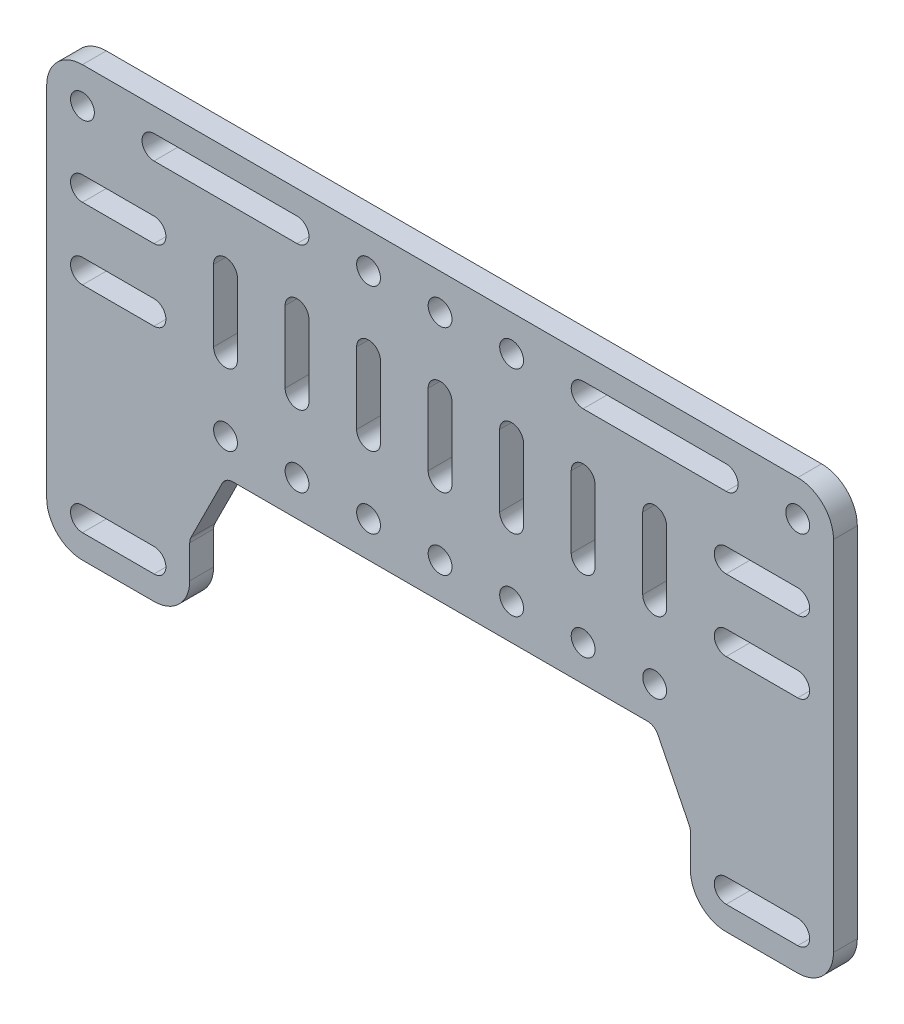
from build123d import *

# Parameters (mm, degrees)
MODEL_R                 = 1.5
SALIENTE_EXTRUIR1_DEPTH = 3


with BuildPart() as part:
    # Model → Saliente-Extruir1 (new body)
    with BuildSketch(Plane.XY):
        with BuildLine():
            Line((-1388.226934946, 304.407679238), (-1478.226934946, 304.407679238))
            ThreePointArc((-1478.226934946, 304.407679238), (-1481.408915461, 303.089659753), (-1482.726934946, 299.907679238))
            Line((-1482.726934946, 299.907679238), (-1482.726934946, 254.907679238))
            ThreePointArc((-1482.726934946, 254.907679238), (-1481.408915461, 251.725698722), (-1478.226934946, 250.407679238))
            Line((-1478.226934946, 250.407679238), (-1469.226934946, 250.407679238))
            ThreePointArc((-1469.226934946, 250.407679238), (-1466.04495443, 251.725698722), (-1464.726934946, 254.907679238))
            Line((-1464.726934946, 254.907679238), (-1464.726934946, 259.053577271))
            ThreePointArc((-1464.726934946, 259.053577271), (-1464.68680843, 259.398206652), (-1464.568575732, 259.724397665))
            Line((-1464.568575732, 259.724397665), (-1460.641524749, 267.578499631))
            ThreePointArc((-1460.641524749, 267.578499631), (-1460.088480631, 268.18365545), (-1459.299883963, 268.407679238))
            Line((-1459.299883963, 268.407679238), (-1407.153985929, 268.407679238))
            ThreePointArc((-1407.153985929, 268.407679238), (-1406.365389261, 268.18365545), (-1405.812345142, 267.578499631))
            Line((-1405.812345142, 267.578499631), (-1401.885294159, 259.724397665))
            ThreePointArc((-1401.885294159, 259.724397665), (-1401.767061462, 259.398206652), (-1401.726934946, 259.053577271))
            Line((-1401.726934946, 259.053577271), (-1401.726934946, 254.907679238))
            ThreePointArc((-1401.726934946, 254.907679238), (-1400.408915461, 251.725698722), (-1397.226934946, 250.407679238))
            Line((-1397.226934946, 250.407679238), (-1388.226934946, 250.407679238))
            ThreePointArc((-1388.226934946, 250.407679238), (-1385.04495443, 251.725698722), (-1383.726934946, 254.907679238))
            Line((-1383.726934946, 254.907679238), (-1383.726934946, 299.907679238))
            ThreePointArc((-1383.726934946, 299.907679238), (-1385.04495443, 303.089659753), (-1388.226934946, 304.407679238))
        make_face()
        with Locations((-1424.226934946, 299.907679238)):
            Circle(MODEL_R, mode=Mode.SUBTRACT)
        with Locations((-1433.226934946, 299.907679238)):
            Circle(MODEL_R, mode=Mode.SUBTRACT)
        with Locations((-1442.226934946, 299.907679238)):
            Circle(MODEL_R, mode=Mode.SUBTRACT)
        with Locations((-1478.226934946, 299.907679238)):
            Circle(MODEL_R, mode=Mode.SUBTRACT)
        with Locations((-1388.226934946, 299.907679238)):
            Circle(MODEL_R, mode=Mode.SUBTRACT)
        with Locations((-1406.226934946, 272.907679238)):
            Circle(MODEL_R, mode=Mode.SUBTRACT)
        with Locations((-1415.226934946, 272.907679238)):
            Circle(MODEL_R, mode=Mode.SUBTRACT)
        with Locations((-1424.226934946, 272.907679238)):
            Circle(MODEL_R, mode=Mode.SUBTRACT)
        with Locations((-1433.226934946, 272.907679238)):
            Circle(MODEL_R, mode=Mode.SUBTRACT)
        with Locations((-1442.226934946, 272.907679238)):
            Circle(MODEL_R, mode=Mode.SUBTRACT)
        with Locations((-1451.226934946, 272.907679238)):
            Circle(MODEL_R, mode=Mode.SUBTRACT)
        with Locations((-1460.226934946, 272.907679238)):
            Circle(MODEL_R, mode=Mode.SUBTRACT)
        with BuildLine():
            Line((-1458.726934946, 281.907679238), (-1458.726934946, 290.907679238))
            ThreePointArc((-1458.726934946, 290.907679238), (-1460.226934946, 292.407679238), (-1461.726934946, 290.907679238))
            Line((-1461.726934946, 290.907679238), (-1461.726934946, 281.907679238))
            ThreePointArc((-1461.726934946, 281.907679238), (-1460.226934946, 280.407679238), (-1458.726934946, 281.907679238))
        make_face(mode=Mode.SUBTRACT)
        with BuildLine():
            Line((-1449.726934946, 281.907679238), (-1449.726934946, 290.907679238))
            ThreePointArc((-1449.726934946, 290.907679238), (-1451.226934946, 292.407679238), (-1452.726934946, 290.907679238))
            Line((-1452.726934946, 290.907679238), (-1452.726934946, 281.907679238))
            ThreePointArc((-1452.726934946, 281.907679238), (-1451.226934946, 280.407679238), (-1449.726934946, 281.907679238))
        make_face(mode=Mode.SUBTRACT)
        with BuildLine():
            Line((-1440.726934946, 281.907679238), (-1440.726934946, 290.907679238))
            ThreePointArc((-1440.726934946, 290.907679238), (-1442.226934946, 292.407679238), (-1443.726934946, 290.907679238))
            Line((-1443.726934946, 290.907679238), (-1443.726934946, 281.907679238))
            ThreePointArc((-1443.726934946, 281.907679238), (-1442.226934946, 280.407679238), (-1440.726934946, 281.907679238))
        make_face(mode=Mode.SUBTRACT)
        with BuildLine():
            Line((-1431.726934946, 281.907679238), (-1431.726934946, 290.907679238))
            ThreePointArc((-1431.726934946, 290.907679238), (-1433.226934946, 292.407679238), (-1434.726934946, 290.907679238))
            Line((-1434.726934946, 290.907679238), (-1434.726934946, 281.907679238))
            ThreePointArc((-1434.726934946, 281.907679238), (-1433.226934946, 280.407679238), (-1431.726934946, 281.907679238))
        make_face(mode=Mode.SUBTRACT)
        with BuildLine():
            Line((-1422.726934946, 281.907679238), (-1422.726934946, 290.907679238))
            ThreePointArc((-1422.726934946, 290.907679238), (-1424.226934946, 292.407679238), (-1425.726934946, 290.907679238))
            Line((-1425.726934946, 290.907679238), (-1425.726934946, 281.907679238))
            ThreePointArc((-1425.726934946, 281.907679238), (-1424.226934946, 280.407679238), (-1422.726934946, 281.907679238))
        make_face(mode=Mode.SUBTRACT)
        with BuildLine():
            Line((-1413.726934946, 281.907679238), (-1413.726934946, 290.907679238))
            ThreePointArc((-1413.726934946, 290.907679238), (-1415.226934946, 292.407679238), (-1416.726934946, 290.907679238))
            Line((-1416.726934946, 290.907679238), (-1416.726934946, 281.907679238))
            ThreePointArc((-1416.726934946, 281.907679238), (-1415.226934946, 280.407679238), (-1413.726934946, 281.907679238))
        make_face(mode=Mode.SUBTRACT)
        with BuildLine():
            Line((-1404.726934946, 281.907679238), (-1404.726934946, 290.907679238))
            ThreePointArc((-1404.726934946, 290.907679238), (-1406.226934946, 292.407679238), (-1407.726934946, 290.907679238))
            Line((-1407.726934946, 290.907679238), (-1407.726934946, 281.907679238))
            ThreePointArc((-1407.726934946, 281.907679238), (-1406.226934946, 280.407679238), (-1404.726934946, 281.907679238))
        make_face(mode=Mode.SUBTRACT)
        with BuildLine():
            Line((-1478.226934946, 292.407679238), (-1469.226934946, 292.407679238))
            ThreePointArc((-1469.226934946, 292.407679238), (-1467.726934946, 290.907679238), (-1469.226934946, 289.407679238))
            Line((-1469.226934946, 289.407679238), (-1478.226934946, 289.407679238))
            ThreePointArc((-1478.226934946, 289.407679238), (-1479.726934946, 290.907679238), (-1478.226934946, 292.407679238))
        make_face(mode=Mode.SUBTRACT)
        with BuildLine():
            Line((-1397.226934946, 292.407679238), (-1388.226934946, 292.407679238))
            ThreePointArc((-1388.226934946, 292.407679238), (-1386.726934946, 290.907679238), (-1388.226934946, 289.407679238))
            Line((-1388.226934946, 289.407679238), (-1397.226934946, 289.407679238))
            ThreePointArc((-1397.226934946, 289.407679238), (-1398.726934946, 290.907679238), (-1397.226934946, 292.407679238))
        make_face(mode=Mode.SUBTRACT)
        with BuildLine():
            Line((-1397.226934946, 280.407679238), (-1388.226934946, 280.407679238))
            ThreePointArc((-1388.226934946, 280.407679238), (-1386.726934946, 281.907679238), (-1388.226934946, 283.407679238))
            Line((-1388.226934946, 283.407679238), (-1397.226934946, 283.407679238))
            ThreePointArc((-1397.226934946, 283.407679238), (-1398.726934946, 281.907679238), (-1397.226934946, 280.407679238))
        make_face(mode=Mode.SUBTRACT)
        with BuildLine():
            Line((-1469.226934946, 298.407679238), (-1451.226934946, 298.407679238))
            ThreePointArc((-1451.226934946, 298.407679238), (-1449.726934946, 299.907679238), (-1451.226934946, 301.407679238))
            Line((-1451.226934946, 301.407679238), (-1469.226934946, 301.407679238))
            ThreePointArc((-1469.226934946, 301.407679238), (-1470.726934946, 299.907679238), (-1469.226934946, 298.407679238))
        make_face(mode=Mode.SUBTRACT)
        with BuildLine():
            Line((-1415.226934946, 301.407679238), (-1397.226934946, 301.407679238))
            ThreePointArc((-1397.226934946, 301.407679238), (-1395.726934946, 299.907679238), (-1397.226934946, 298.407679238))
            Line((-1397.226934946, 298.407679238), (-1415.226934946, 298.407679238))
            ThreePointArc((-1415.226934946, 298.407679238), (-1416.726934946, 299.907679238), (-1415.226934946, 301.407679238))
        make_face(mode=Mode.SUBTRACT)
        with BuildLine():
            Line((-1478.226934946, 280.407679238), (-1469.226934946, 280.407679238))
            ThreePointArc((-1469.226934946, 280.407679238), (-1467.726934946, 281.907679238), (-1469.226934946, 283.407679238))
            Line((-1469.226934946, 283.407679238), (-1478.226934946, 283.407679238))
            ThreePointArc((-1478.226934946, 283.407679238), (-1479.726934946, 281.907679238), (-1478.226934946, 280.407679238))
        make_face(mode=Mode.SUBTRACT)
        with BuildLine():
            Line((-1478.226934946, 256.407679238), (-1469.226934946, 256.407679238))
            ThreePointArc((-1469.226934946, 256.407679238), (-1467.726934946, 254.907679238), (-1469.226934946, 253.407679238))
            Line((-1469.226934946, 253.407679238), (-1478.226934946, 253.407679238))
            ThreePointArc((-1478.226934946, 253.407679238), (-1479.726934946, 254.907679238), (-1478.226934946, 256.407679238))
        make_face(mode=Mode.SUBTRACT)
        with BuildLine():
            Line((-1397.226934946, 256.407679238), (-1388.226934946, 256.407679238))
            ThreePointArc((-1388.226934946, 256.407679238), (-1386.726934946, 254.907679238), (-1388.226934946, 253.407679238))
            Line((-1388.226934946, 253.407679238), (-1397.226934946, 253.407679238))
            ThreePointArc((-1397.226934946, 253.407679238), (-1398.726934946, 254.907679238), (-1397.226934946, 256.407679238))
        make_face(mode=Mode.SUBTRACT)
    extrude(amount=SALIENTE_EXTRUIR1_DEPTH)


solid = part.part
